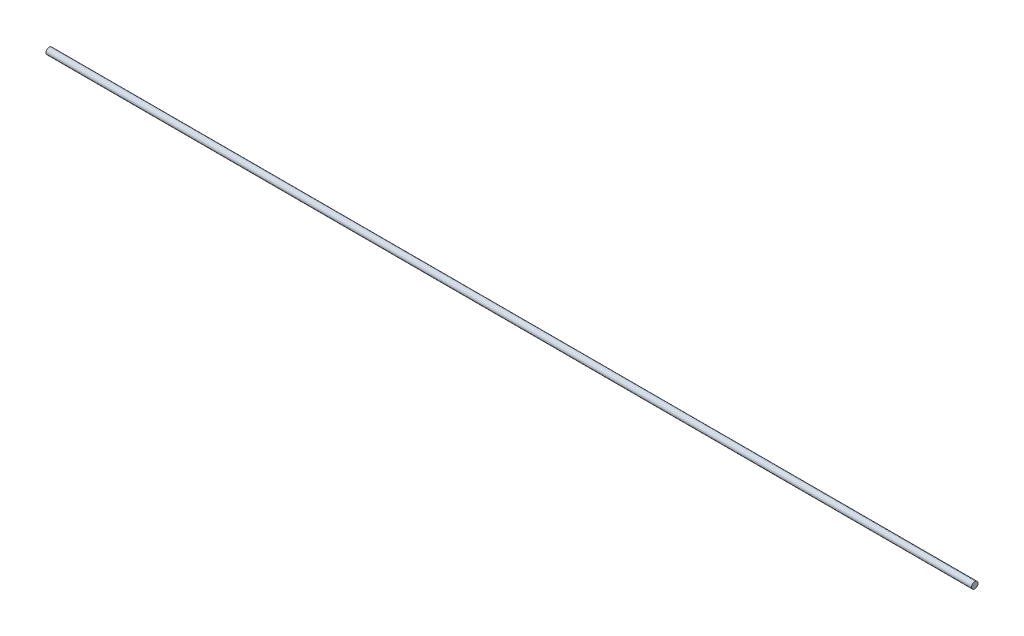
from build123d import *

# Parameters (mm, degrees)
SKETCH_1_R      = 0.5
EXTRUDE_1_DEPTH = 145


with BuildPart() as part:
    # 草图1 → 凸台-拉伸1 (new body)
    with BuildSketch(Plane(origin=(0, 0, 0), x_dir=(0, 0, -1), z_dir=(1, 0, 0))):
        Circle(SKETCH_1_R)
    extrude(amount=EXTRUDE_1_DEPTH)


solid = part.part
